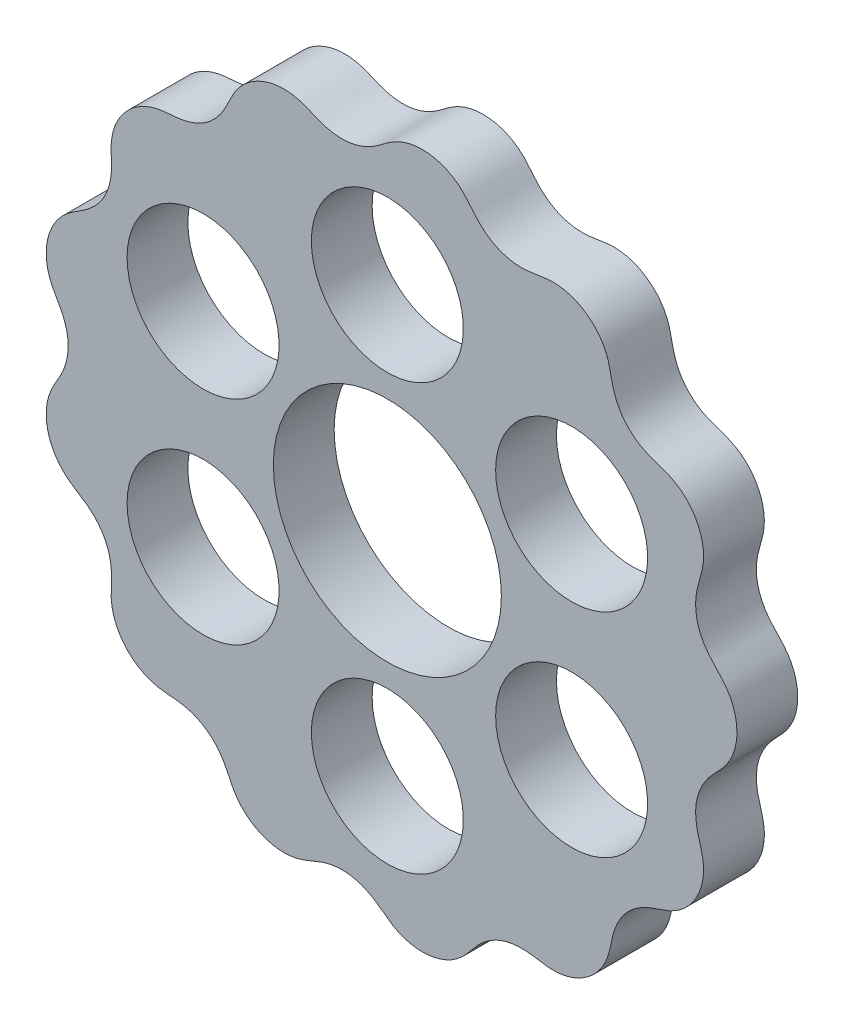
from build123d import *

# Parameters (mm, degrees)
LOBEBASE_DEPTH      = 4
LOBEBASE_DEPTH_BACK = 4
LOBEBASESKETCH_R    = 6.5
SKETCH_5_R          = 5
CUT_EXTRUDE_1_DEPTH = 10
SKETCH_6_R          = 7.5
CUT_EXTRUDE_2_DEPTH = 10
SKETCH_7_W          = 69.827871662
SKETCH_7_H          = 56.498152212
CUT_EXTRUDE_3_DEPTH = 4


with BuildPart() as part:
    # LobeBaseSketch → LobeBase (new, two sides: drawn at the far end of the back side and taken through both)
    with BuildSketch(Plane.XY.offset(-LOBEBASE_DEPTH_BACK)):
        with BuildLine():
            add(Edge.make_bspline(
                [(23, 0), (23, 0.04430048), (22.998484829, 0.132821599), (22.991681512, 0.265248966), (22.980399102, 0.396891972), (22.964721454, 0.527368676), (22.944764325, 0.656309365), (22.92067373, 0.783360531), (22.892623822, 0.908188775), (22.860814288, 1.030484612), (22.825467261, 1.149966178), (22.786823724, 1.266382827), (22.745139396, 1.379518628), (22.70068008, 1.489195762), (22.653716425, 1.595277859), (22.604518087, 1.6976733), (22.553347199, 1.796338552), (22.500451113, 1.891281616), (22.446054299, 1.982565722), (22.390349303, 2.070313421), (22.333486628, 2.154711337), (22.27556338, 2.236015872), (22.216610506, 2.314560327), (22.156578465, 2.390764035), (22.095321193, 2.465144312), (22.032578346, 2.538332356), (21.967956062, 2.611094541), (21.900906971, 2.684361049), (21.830711136, 2.759264251), (21.756461301, 2.837189672), (21.677058807, 2.919842341), (21.591231419, 3.009330157), (21.497591992, 3.108261919), (21.394767597, 3.219848144), (21.281640661, 3.347972943), (21.157749072, 3.497169882), (21.023871596, 3.672383574), (20.882743958, 3.878351565), (20.739678847, 4.118461681), (20.602640028, 4.393136809), (20.481250295, 4.698228691), (20.384604573, 5.024353774), (20.318622227, 5.3580367), (20.28432423, 5.684594767), (20.278018181, 5.991492629), (20.293111311, 6.27058525), (20.322355531, 6.518546132), (20.359472285, 6.735906117), (20.399837565, 6.925588738), (20.44046393, 7.091610322), (20.479653705, 7.238199896), (20.516591418, 7.369316033), (20.551000734, 7.488439534), (20.58289754, 7.598525017), (20.612428755, 7.702030169), (20.639774827, 7.800975292), (20.665095204, 7.897008829), (20.688501121, 7.991468017), (20.710044973, 8.085430867), (20.729719356, 8.179759006), (20.747461459, 8.275132318), (20.763160208, 8.372076746), (20.776664596, 8.470986612), (20.787792327, 8.572142657), (20.796338262, 8.675726789), (20.80208241, 8.78183431), (20.804797326, 8.890484256), (20.804254868, 9.001628295), (20.800232299, 9.115158563), (20.792517741, 9.230914694), (20.780915005, 9.348690247), (20.765247817, 9.468238697), (20.745363455, 9.589279067), (20.72113584, 9.711501322), (20.692468074, 9.834571536), (20.659294457, 9.958136899), (20.621581998, 10.081830577), (20.579331433, 10.205276427), (20.532577753, 10.328093577), (20.481390276, 10.449900868), (20.425872247, 10.570321136), (20.366160004, 10.688985342), (20.302421697, 10.805536507), (20.234855594, 10.919633458), (20.163687961, 11.030954354), (20.089170544, 11.139199971), (20.011577658, 11.244096741), (19.931202875, 11.345399504), (19.848355338, 11.442893982), (19.763355685, 11.536398941), (19.676531595, 11.625768031), (19.588212927, 11.710891307), (19.49872646, 11.79169641), (19.408390185, 11.868149415), (19.317507126, 11.940255348), (19.226358626, 12.008058401), (19.135197027, 12.071641845), (19.044237626, 12.131127717), (18.9536498, 12.186676318), (18.863547086, 12.238485645), (18.773976021, 12.286790885), (18.684903431, 12.3318642), (18.596201825, 12.374015095), (18.507632464, 12.413591846), (18.418825605, 12.450984637), (18.329257392, 12.486631377), (18.238222928, 12.52102762), (18.144805263, 12.554742624), (18.047840684, 12.588444485), (17.945881972, 12.622938399), (17.837163944, 12.659223525), (17.719580505, 12.698575074), (17.590691028, 12.742658387), (17.447787844, 12.793678204), (17.288076353, 12.85455437), (17.109040524, 12.929086407), (16.909072043, 13.022014461), (16.688391628, 13.138804776), (16.450129029, 13.284926052), (16.201139284, 13.464453685), (15.951870746, 13.678186509), (15.714737327, 13.922042422), (15.501242673, 14.186840454), (15.319114204, 14.460054189), (15.170907927, 14.728868183), (15.054571422, 14.983006553), (14.965232724, 15.216155477), (14.897085757, 15.425867201), (14.844677528, 15.612581502), (14.80349631, 15.778466327), (14.770073561, 15.926477345), (14.741847574, 16.059740729), (14.716956059, 16.181210158), (14.694040003, 16.293509197), (14.672087353, 16.398882298), (14.650319006, 16.499202206), (14.628110076, 16.596002646), (14.604937613, 16.690519375), (14.580347033, 16.783731274), (14.553931362, 16.876397835), (14.525319026, 16.969091875), (14.494167256, 17.062227475), (14.460159091, 17.156083614), (14.423002649, 17.250824159), (14.382431752, 17.346514846), (14.338207319, 17.443137829), (14.29011911, 17.540604263), (14.237987578, 17.638765329), (14.181665623, 17.737422008), (14.121040165, 17.836333837), (14.056033424, 17.935226851), (13.986603883, 18.03380084), (13.91274689, 18.131736042), (13.834494888, 18.22869934), (13.751917262, 18.324350027), (13.665119796, 18.418345173), (13.574243753, 18.510344633), (13.479464588, 18.600015687), (13.380990285, 18.687037355), (13.279059355, 18.771104348), (13.173938492, 18.851930686), (13.065919921, 18.929252959), (12.955318426, 19.002833222), (12.842468116, 19.072461521), (12.727718906, 19.13795803), (12.611432764, 19.199174795), (12.493979716, 19.255997059), (12.375733639, 19.308344177), (12.257067844, 19.35617008), (12.138350469, 19.399463301), (12.019939668, 19.438246533), (11.902178613, 19.47257572), (11.785390277, 19.502538651), (11.669871995, 19.528253064), (11.555889744, 19.549864233), (11.443672107, 19.567542035), (11.333403819, 19.581477471), (11.225218807, 19.591878654), (11.119192548, 19.598966235), (11.015333563, 19.602968297), (10.913573759, 19.604114714), (10.813757283, 19.602631055), (10.715627414, 19.598732127), (10.618810907, 19.592615366), (10.522799042, 19.584454433), (10.426924462, 19.574393629), (10.330332716, 19.562544165), (10.231947338, 19.548983965), (10.130427432, 19.533763794), (10.024117354, 19.516924062), (9.910989783, 19.498529159), (9.788587241, 19.478729476), (9.65397474, 19.457865385), (9.503730163, 19.436630768), (9.334022097, 19.416312306), (9.140856978, 19.399105048), (8.920607862, 19.388458767), (8.670929893, 19.389316152), (8.392052896, 19.407973966), (8.088152775, 19.451226486), (7.76810985, 19.524636637), (7.444813142, 19.63035893), (7.132715232, 19.765610031), (6.844479729, 19.922889459), (6.588325496, 20.092037539), (6.367210647, 20.26300162), (6.179755452, 20.427926976), (6.021956411, 20.581948011), (5.888780766, 20.722919996), (5.775226087, 20.850665847), (5.676847562, 20.966190769), (5.58992411, 21.071072366), (5.51143411, 21.167060539), (5.438954984, 21.255846778), (5.370547556, 21.33894812), (5.304651656, 21.417660732), (5.240001218, 21.49305226), (5.175558907, 21.565973887), (5.1104673, 21.637081113), (5.044013087, 21.706857302), (4.975601053, 21.775636984), (4.904735259, 21.843627513), (4.831005402, 21.910928614), (4.75407688, 21.97754974), (4.673683455, 22.0434254), (4.589621725, 22.108428684), (4.501746821, 22.17238322), (4.409968919, 22.235073796), (4.31425026, 22.29625583), (4.214602464, 22.35566385), (4.111083979, 22.413019126), (4.003797556, 22.468036541), (3.892887679, 22.5204308), (3.778537881, 22.569922019), (3.660967934, 22.616240759), (3.540430872, 22.659132534), (3.417209852, 22.698361807), (3.291614852, 22.733715509), (3.163979201, 22.765006078), (3.034655965, 22.792074038), (2.904014192, 22.814790105), (2.772435045, 22.833056845), (2.640307832, 22.846809855), (2.508025961, 22.856018497), (2.375982836, 22.86068616), (2.244567722, 22.860850048), (2.11416159, 22.856580511), (1.98513297, 22.84797989), (1.857833821, 22.835180879), (1.732595443, 22.818344407), (1.609724419, 22.797657011), (1.489498614, 22.773327705), (1.372163211, 22.745584317), (1.257926768, 22.714669277), (1.146957286, 22.680834824), (1.039378219, 22.644337604), (0.935264379, 22.605432591), (0.834637638, 22.564366299), (0.737462285, 22.521369181), (0.643639869, 22.476647154), (0.553003271, 22.430372117), (0.465309662, 22.382671373), (0.3802319, 22.33361582), (0.297347741, 22.283206822), (0.216126031, 22.231361736), (0.135908796, 22.177898198), (0.055887773, 22.122517596), (-0.024926414, 22.064788671), (-0.10774466, 22.004133225), (-0.194051745, 21.939817627), (-0.285672697, 21.870956745), (-0.384853394, 21.7965417), (-0.494350818, 21.715509915), (-0.617517565, 21.626885459), (-0.758344135, 21.530027084), (-0.921386741, 21.425022507), (-1.111460075, 21.313240826), (-1.332937384, 21.197968865), (-1.58854142, 21.084888936), (-1.877732062, 20.981957712), (-2.195231396, 20.89822781), (-2.530628014, 20.841596779), (-2.869831309, 20.81631655), (-3.198142567, 20.82163085), (-3.503562909, 20.852363229), (-3.778801354, 20.900987211), (-4.021429321, 20.959906589), (-4.232730576, 21.022952572), (-4.416164701, 21.085887256), (-4.576078833, 21.146229099), (-4.716875799, 21.202802558), (-4.842583602, 21.255275257), (-4.956690974, 21.303792442), (-5.062129075, 21.348726023), (-5.161319964, 21.39051809), (-5.25624746, 21.429591294), (-5.34852877, 21.466302621), (-5.439477973, 21.50092368), (-5.530158904, 21.533636423), (-5.621427799, 21.564537358), (-5.713967158, 21.593646084), (-5.808312477, 21.620915731), (-5.904873405, 21.646243923), (-6.003950609, 21.669483534), (-6.105749397, 21.690452847), (-6.210390895, 21.708944962), (-6.317921413, 21.724736388), (-6.428320473, 21.737594818), (-6.541507845, 21.74728614), (-6.65734987, 21.753580689), (-6.775665262, 21.756258825), (-6.89623054, 21.755115841), (-7.018785185, 21.749966263), (-7.143036618, 21.74064756), (-7.268665028, 21.727023289), (-7.395328098, 21.708985704), (-7.522665645, 21.686457836), (-7.650304179, 21.659395078), (-7.777861387, 21.627786257), (-7.904950534, 21.59165424), (-8.031184762, 21.55105606), (-8.156181288, 21.506082576), (-8.279565467, 21.456857684), (-8.400974717, 21.403537081), (-8.520062268, 21.346306591), (-8.636500735, 21.285380058), (-8.749985478, 21.22099682), (-8.86023774, 21.153418758), (-8.967007541, 21.082926933), (-9.070076319, 21.009817801), (-9.169259295, 20.93439901), (-9.264407566, 20.856984762), (-9.355409911, 20.77789073), (-9.442194321, 20.6974285), (-9.524729264, 20.61589949), (-9.603024693, 20.533588321), (-9.677132859, 20.450755529), (-9.747148956, 20.367629555), (-9.813211701, 20.28439786), (-9.875503961, 20.201197021), (-9.934253601, 20.118101583), (-9.989734795, 20.035111419), (-10.04227016, 19.952137277), (-10.092234209, 19.868984137), (-10.140058848, 19.785331983), (-10.186241938, 19.700713563), (-10.231360385, 19.614488851), (-10.276089825, 19.525816201), (-10.321233749, 19.433620913), (-10.367765929, 19.336563377), (-10.416891005, 19.233011715), (-10.470128755, 19.121028896), (-10.529426561, 18.998392825), (-10.597299461, 18.862681325), (-10.676982864, 18.711472122), (-10.772551863, 18.54272551), (-10.888905904, 18.355416264), (-11.031444771, 18.150422374), (-11.205220041, 17.931509951), (-11.413451112, 17.705975286), (-11.655671585, 17.484286842), (-11.92633279, 17.278275974), (-12.214934083, 17.098255812), (-12.508108943, 16.950387542), (-12.792827273, 16.835663802), (-13.059135504, 16.750808516), (-13.3013531, 16.690224196), (-13.517749999, 16.647852052), (-13.709420056, 16.618331859), (-13.879059241, 16.597446105), (-14.03001976, 16.582107802), (-14.16571377, 16.570150741), (-14.289297891, 16.560082235), (-14.403540369, 16.550869416), (-14.51079128, 16.541778149), (-14.613003628, 16.532260746), (-14.711775274, 16.521881748), (-14.808396002, 16.510270971), (-14.903892348, 16.497095137), (-14.999067322, 16.482041786), (-15.094534355, 16.464811098), (-15.190745823, 16.445112715), (-15.288016876, 16.422665616), (-15.386545369, 16.397199796), (-15.486428645, 16.368458945), (-15.587677804, 16.336203571), (-15.690229991, 16.30021426), (-15.793959114, 16.260294834), (-15.898685336, 16.216275279), (-16.004183578, 16.168014352), (-16.110191247, 16.115401819), (-16.216415327, 16.058360278), (-16.322538948, 15.99684657), (-16.428227511, 15.930852748), (-16.53313443, 15.860406622), (-16.636906524, 15.78557187), (-16.7391891, 15.706447726), (-16.839630718, 15.623168259), (-16.937887665, 15.535901247), (-17.033628131, 15.444846664), (-17.126536074, 15.35023479), (-17.21631478, 15.252323965), (-17.302690098, 15.151398), (-17.38541333, 15.04776326), (-17.464263785, 14.941745433), (-17.539050955, 14.833686014), (-17.609616322, 14.723938498), (-17.67583476, 14.612864315), (-17.737615539, 14.500828503), (-17.794902902, 14.388195132), (-17.847676206, 14.275322482), (-17.895949621, 14.162557963), (-17.939771366, 14.050232778), (-17.979222483, 13.938656284), (-18.014415125, 13.828110032), (-18.045490377, 13.71884141), (-18.072615581, 13.611056834), (-18.09598119, 13.504914336), (-18.115797148, 13.400515442), (-18.132288848, 13.297896101), (-18.145692695, 13.197016426), (-18.1562514, 13.097748889), (-18.164209149, 12.999864534), (-18.169806926, 12.903016633), (-18.173278446, 12.806721111), (-18.174847401, 12.710332869), (-18.174727181, 12.613017091), (-18.173124897, 12.513714551), (-18.170252571, 12.411100251), (-18.166349883, 12.303535488), (-18.161725121, 12.189015483), (-18.156823797, 12.065118806), (-18.152337572, 11.928972893), (-18.149367762, 11.777264218), (-18.149653491, 11.606344395), (-18.155855176, 11.412513562), (-18.171834615, 11.192587042), (-18.202781103, 10.944832853), (-18.254917788, 10.670238134), (-18.33448606, 10.373767303), (-18.44593788, 10.064906467), (-18.589858451, 9.756710369), (-18.761742664, 9.463190724), (-18.952618299, 9.196014722), (-19.15140908, 8.96211669), (-19.34777909, 8.76322146), (-19.534097182, 8.597012579), (-19.706015803, 8.458929255), (-19.862012493, 8.343716906), (-20.002514437, 8.246388229), (-20.129055273, 8.162651985), (-20.243649629, 8.089004382), (-20.348398865, 8.022656758), (-20.445274145, 7.961408085), (-20.536015189, 7.903516184), (-20.62209677, 7.847588496), (-20.704731359, 7.792496877), (-20.784888967, 7.737314154), (-20.863323667, 7.681268167), (-20.94060128, 7.623709071), (-21.017125639, 7.564086312), (-21.093162369, 7.501932562), (-21.168859921, 7.43685253), (-21.244268013, 7.368515193), (-21.319353722, 7.29664836), (-21.39401558, 7.221034815), (-21.468095965, 7.141509485), (-21.54139206, 7.057957261), (-21.613665617, 6.970311178), (-21.6846517, 6.878550772), (-21.754066566, 6.782700468), (-21.821614792, 6.682827901), (-21.886995747, 6.579042111), (-21.949909463, 6.47149156), (-22.010061979, 6.360361937), (-22.067170162, 6.245873758), (-22.120966062, 6.128279724), (-22.1712008, 6.007861871), (-22.217648003, 5.884928489), (-22.260106801, 5.759810847), (-22.298404368, 5.632859719), (-22.332398036, 5.504441744), (-22.361976947, 5.374935629), (-22.387063266, 5.244728221), (-22.407612935, 5.114210464), (-22.42361597, 4.983773269), (-22.435096285, 4.853803309), (-22.442111054, 4.724678762), (-22.444749579, 4.596765017), (-22.443131682, 4.470410355), (-22.437405586, 4.345941609), (-22.427745288, 4.223659813), (-22.4143474, 4.10383582), (-22.397427446, 3.986705894), (-22.377215578, 3.872467212), (-22.353951687, 3.761273263), (-22.327879873, 3.653229049), (-22.299242213, 3.548385995), (-22.268271788, 3.44673643), (-22.235184876, 3.348207441), (-22.200172271, 3.252653847), (-22.163389616, 3.159849933), (-22.124946724, 3.069479491), (-22.084895846, 2.981123517), (-22.043218964, 2.894244771), (-21.999814355, 2.808168092), (-21.954483008, 2.722055118), (-21.906916066, 2.634871704), (-21.856685503, 2.54534609), (-21.803242007, 2.451915893), (-21.745926884, 2.352662699), (-21.68400932, 2.245235398), (-21.616766805, 2.126769032), (-21.543634632, 1.993817811), (-21.46445723, 1.842343038), (-21.37987087, 1.667832293), (-21.291815011, 1.465671015), (-21.204079652, 1.231914025), (-21.122633866, 0.964543351), (-21.055311206, 0.665054247), (-21.010462104, 0.339777315), (-20.994671573, 0), (-21.010462104, -0.339777315), (-21.055311206, -0.665054247), (-21.122633866, -0.964543351), (-21.204079652, -1.231914025), (-21.291815011, -1.465671015), (-21.37987087, -1.667832293), (-21.46445723, -1.842343038), (-21.543634632, -1.993817811), (-21.616766805, -2.126769032), (-21.68400932, -2.245235398), (-21.745926884, -2.352662699), (-21.803242007, -2.451915893), (-21.856685503, -2.54534609), (-21.906916066, -2.634871704), (-21.954483008, -2.722055118), (-21.999814355, -2.808168092), (-22.043218964, -2.894244771), (-22.084895846, -2.981123517), (-22.124946724, -3.069479491), (-22.163389616, -3.159849933), (-22.200172271, -3.252653847), (-22.235184876, -3.348207441), (-22.268271788, -3.44673643), (-22.299242213, -3.548385995), (-22.327879873, -3.653229049), (-22.353951687, -3.761273263), (-22.377215578, -3.872467212), (-22.397427446, -3.986705894), (-22.4143474, -4.10383582), (-22.427745288, -4.223659813), (-22.437405586, -4.345941609), (-22.443131682, -4.470410355), (-22.444749579, -4.596765017), (-22.442111054, -4.724678762), (-22.435096285, -4.853803309), (-22.42361597, -4.983773269), (-22.407612935, -5.114210464), (-22.387063266, -5.244728221), (-22.361976947, -5.374935629), (-22.332398036, -5.504441744), (-22.298404368, -5.632859719), (-22.260106801, -5.759810847), (-22.217648003, -5.884928489), (-22.1712008, -6.007861871), (-22.120966062, -6.128279724), (-22.067170162, -6.245873758), (-22.010061979, -6.360361937), (-21.949909463, -6.47149156), (-21.886995747, -6.579042111), (-21.821614792, -6.682827901), (-21.754066566, -6.782700468), (-21.6846517, -6.878550772), (-21.613665617, -6.970311178), (-21.54139206, -7.057957261), (-21.468095965, -7.141509485), (-21.39401558, -7.221034815), (-21.319353722, -7.29664836), (-21.244268013, -7.368515193), (-21.168859921, -7.43685253), (-21.093162369, -7.501932562), (-21.017125639, -7.564086312), (-20.94060128, -7.623709071), (-20.863323667, -7.681268167), (-20.784888967, -7.737314154), (-20.704731359, -7.792496877), (-20.62209677, -7.847588496), (-20.536015189, -7.903516184), (-20.445274145, -7.961408085), (-20.348398865, -8.022656758), (-20.243649629, -8.089004382), (-20.129055273, -8.162651985), (-20.002514437, -8.246388229), (-19.862012493, -8.343716906), (-19.706015803, -8.458929255), (-19.534097182, -8.597012579), (-19.34777909, -8.76322146), (-19.15140908, -8.96211669), (-18.952618299, -9.196014722), (-18.761742664, -9.463190724), (-18.589858451, -9.756710369), (-18.44593788, -10.064906467), (-18.33448606, -10.373767303), (-18.254917788, -10.670238134), (-18.202781103, -10.944832853), (-18.171834615, -11.192587042), (-18.155855176, -11.412513562), (-18.149653491, -11.606344395), (-18.149367762, -11.777264218), (-18.152337572, -11.928972893), (-18.156823797, -12.065118806), (-18.161725121, -12.189015483), (-18.166349883, -12.303535488), (-18.170252571, -12.411100251), (-18.173124897, -12.513714551), (-18.174727181, -12.613017091), (-18.174847401, -12.710332869), (-18.173278446, -12.806721111), (-18.169806926, -12.903016633), (-18.164209149, -12.999864534), (-18.1562514, -13.097748889), (-18.145692695, -13.197016426), (-18.132288848, -13.297896101), (-18.115797148, -13.400515442), (-18.09598119, -13.504914336), (-18.072615581, -13.611056834), (-18.045490377, -13.71884141), (-18.014415125, -13.828110032), (-17.979222483, -13.938656284), (-17.939771366, -14.050232778), (-17.895949621, -14.162557963), (-17.847676206, -14.275322482), (-17.794902902, -14.388195132), (-17.737615539, -14.500828503), (-17.67583476, -14.612864315), (-17.609616322, -14.723938498), (-17.539050955, -14.833686014), (-17.464263785, -14.941745433), (-17.38541333, -15.04776326), (-17.302690098, -15.151398), (-17.21631478, -15.252323965), (-17.126536074, -15.35023479), (-17.033628131, -15.444846664), (-16.937887665, -15.535901247), (-16.839630718, -15.623168259), (-16.7391891, -15.706447726), (-16.636906524, -15.78557187), (-16.53313443, -15.860406622), (-16.428227511, -15.930852748), (-16.322538948, -15.99684657), (-16.216415327, -16.058360278), (-16.110191247, -16.115401819), (-16.004183578, -16.168014352), (-15.898685336, -16.216275279), (-15.793959114, -16.260294834), (-15.690229991, -16.30021426), (-15.587677804, -16.336203571), (-15.486428645, -16.368458945), (-15.386545369, -16.397199796), (-15.288016876, -16.422665616), (-15.190745823, -16.445112715), (-15.094534355, -16.464811098), (-14.999067322, -16.482041786), (-14.903892348, -16.497095137), (-14.808396002, -16.510270971), (-14.711775274, -16.521881748), (-14.613003628, -16.532260746), (-14.51079128, -16.541778149), (-14.403540369, -16.550869416), (-14.289297891, -16.560082235), (-14.16571377, -16.570150741), (-14.03001976, -16.582107802), (-13.879059241, -16.597446105), (-13.709420056, -16.618331859), (-13.517749999, -16.647852052), (-13.3013531, -16.690224196), (-13.059135504, -16.750808516), (-12.792827273, -16.835663802), (-12.508108943, -16.950387542), (-12.214934083, -17.098255812), (-11.92633279, -17.278275974), (-11.655671585, -17.484286842), (-11.413451112, -17.705975286), (-11.205220041, -17.931509951), (-11.031444771, -18.150422374), (-10.888905904, -18.355416264), (-10.772551863, -18.54272551), (-10.676982864, -18.711472122), (-10.597299461, -18.862681325), (-10.529426561, -18.998392825), (-10.470128755, -19.121028896), (-10.416891005, -19.233011715), (-10.367765929, -19.336563377), (-10.321233749, -19.433620913), (-10.276089825, -19.525816201), (-10.231360385, -19.614488851), (-10.186241938, -19.700713563), (-10.140058848, -19.785331983), (-10.092234209, -19.868984137), (-10.04227016, -19.952137277), (-9.989734795, -20.035111419), (-9.934253601, -20.118101583), (-9.875503961, -20.201197021), (-9.813211701, -20.28439786), (-9.747148956, -20.367629555), (-9.677132859, -20.450755529), (-9.603024693, -20.533588321), (-9.524729264, -20.61589949), (-9.442194321, -20.6974285), (-9.355409911, -20.77789073), (-9.264407566, -20.856984762), (-9.169259295, -20.93439901), (-9.070076319, -21.009817801), (-8.967007541, -21.082926933), (-8.86023774, -21.153418758), (-8.749985478, -21.22099682), (-8.636500735, -21.285380058), (-8.520062268, -21.346306591), (-8.400974717, -21.403537081), (-8.279565467, -21.456857684), (-8.156181288, -21.506082576), (-8.031184762, -21.55105606), (-7.904950534, -21.59165424), (-7.777861387, -21.627786257), (-7.650304179, -21.659395078), (-7.522665645, -21.686457836), (-7.395328098, -21.708985704), (-7.268665028, -21.727023289), (-7.143036618, -21.74064756), (-7.018785185, -21.749966263), (-6.89623054, -21.755115841), (-6.775665262, -21.756258825), (-6.65734987, -21.753580689), (-6.541507845, -21.74728614), (-6.428320473, -21.737594818), (-6.317921413, -21.724736388), (-6.210390895, -21.708944962), (-6.105749397, -21.690452847), (-6.003950609, -21.669483534), (-5.904873405, -21.646243923), (-5.808312477, -21.620915731), (-5.713967158, -21.593646084), (-5.621427799, -21.564537358), (-5.530158904, -21.533636423), (-5.439477973, -21.50092368), (-5.34852877, -21.466302621), (-5.25624746, -21.429591294), (-5.161319964, -21.39051809), (-5.062129075, -21.348726023), (-4.956690974, -21.303792442), (-4.842583602, -21.255275257), (-4.716875799, -21.202802558), (-4.576078833, -21.146229099), (-4.416164701, -21.085887256), (-4.232730576, -21.022952572), (-4.021429321, -20.959906589), (-3.778801354, -20.900987211), (-3.503562909, -20.852363229), (-3.198142567, -20.82163085), (-2.869831309, -20.81631655), (-2.530628014, -20.841596779), (-2.195231396, -20.89822781), (-1.877732062, -20.981957712), (-1.58854142, -21.084888936), (-1.332937384, -21.197968865), (-1.111460075, -21.313240826), (-0.921386741, -21.425022507), (-0.758344135, -21.530027084), (-0.617517565, -21.626885459), (-0.494350818, -21.715509915), (-0.384853394, -21.7965417), (-0.285672697, -21.870956745), (-0.194051745, -21.939817627), (-0.10774466, -22.004133225), (-0.024926414, -22.064788671), (0.055887773, -22.122517596), (0.135908796, -22.177898198), (0.216126031, -22.231361736), (0.297347741, -22.283206822), (0.3802319, -22.33361582), (0.465309662, -22.382671373), (0.553003271, -22.430372117), (0.643639869, -22.476647154), (0.737462285, -22.521369181), (0.834637638, -22.564366299), (0.935264379, -22.605432591), (1.039378219, -22.644337604), (1.146957286, -22.680834824), (1.257926768, -22.714669277), (1.372163211, -22.745584317), (1.489498614, -22.773327705), (1.609724419, -22.797657011), (1.732595443, -22.818344407), (1.857833821, -22.835180879), (1.98513297, -22.84797989), (2.11416159, -22.856580511), (2.244567722, -22.860850048), (2.375982836, -22.86068616), (2.508025961, -22.856018497), (2.640307832, -22.846809855), (2.772435045, -22.833056845), (2.904014192, -22.814790105), (3.034655965, -22.792074038), (3.163979201, -22.765006078), (3.291614852, -22.733715509), (3.417209852, -22.698361807), (3.540430872, -22.659132534), (3.660967934, -22.616240759), (3.778537881, -22.569922019), (3.892887679, -22.5204308), (4.003797556, -22.468036541), (4.111083979, -22.413019126), (4.214602464, -22.35566385), (4.31425026, -22.29625583), (4.409968919, -22.235073796), (4.501746821, -22.17238322), (4.589621725, -22.108428684), (4.673683455, -22.0434254), (4.75407688, -21.97754974), (4.831005402, -21.910928614), (4.904735259, -21.843627513), (4.975601053, -21.775636984), (5.044013087, -21.706857302), (5.1104673, -21.637081113), (5.175558907, -21.565973887), (5.240001218, -21.49305226), (5.304651656, -21.417660732), (5.370547556, -21.33894812), (5.438954984, -21.255846778), (5.51143411, -21.167060539), (5.58992411, -21.071072366), (5.676847562, -20.966190769), (5.775226087, -20.850665847), (5.888780766, -20.722919996), (6.021956411, -20.581948011), (6.179755452, -20.427926976), (6.367210647, -20.26300162), (6.588325496, -20.092037539), (6.844479729, -19.922889459), (7.132715232, -19.765610031), (7.444813142, -19.63035893), (7.76810985, -19.524636637), (8.088152775, -19.451226486), (8.392052896, -19.407973966), (8.670929893, -19.389316152), (8.920607862, -19.388458767), (9.140856978, -19.399105048), (9.334022097, -19.416312306), (9.503730163, -19.436630768), (9.65397474, -19.457865385), (9.788587241, -19.478729476), (9.910989783, -19.498529159), (10.024117354, -19.516924062), (10.130427432, -19.533763794), (10.231947338, -19.548983965), (10.330332716, -19.562544165), (10.426924462, -19.574393629), (10.522799042, -19.584454433), (10.618810907, -19.592615366), (10.715627414, -19.598732127), (10.813757283, -19.602631055), (10.913573759, -19.604114714), (11.015333563, -19.602968297), (11.119192548, -19.598966235), (11.225218807, -19.591878654), (11.333403819, -19.581477471), (11.443672107, -19.567542035), (11.555889744, -19.549864233), (11.669871995, -19.528253064), (11.785390277, -19.502538651), (11.902178613, -19.47257572), (12.019939668, -19.438246533), (12.138350469, -19.399463301), (12.257067844, -19.35617008), (12.375733639, -19.308344177), (12.493979716, -19.255997059), (12.611432764, -19.199174795), (12.727718906, -19.13795803), (12.842468116, -19.072461521), (12.955318426, -19.002833222), (13.065919921, -18.929252959), (13.173938492, -18.851930686), (13.279059355, -18.771104348), (13.380990285, -18.687037355), (13.479464588, -18.600015687), (13.574243753, -18.510344633), (13.665119796, -18.418345173), (13.751917262, -18.324350027), (13.834494888, -18.22869934), (13.91274689, -18.131736042), (13.986603883, -18.03380084), (14.056033424, -17.935226851), (14.121040165, -17.836333837), (14.181665623, -17.737422008), (14.237987578, -17.638765329), (14.29011911, -17.540604263), (14.338207319, -17.443137829), (14.382431752, -17.346514846), (14.423002649, -17.250824159), (14.460159091, -17.156083614), (14.494167256, -17.062227475), (14.525319026, -16.969091875), (14.553931362, -16.876397835), (14.580347033, -16.783731274), (14.604937613, -16.690519375), (14.628110076, -16.596002646), (14.650319006, -16.499202206), (14.672087353, -16.398882298), (14.694040003, -16.293509197), (14.716956059, -16.181210158), (14.741847574, -16.059740729), (14.770073561, -15.926477345), (14.80349631, -15.778466327), (14.844677528, -15.612581502), (14.897085757, -15.425867201), (14.965232724, -15.216155477), (15.054571422, -14.983006553), (15.170907927, -14.728868183), (15.319114204, -14.460054189), (15.501242673, -14.186840454), (15.714737327, -13.922042422), (15.951870746, -13.678186509), (16.201139284, -13.464453685), (16.450129029, -13.284926052), (16.688391628, -13.138804776), (16.909072043, -13.022014461), (17.109040524, -12.929086407), (17.288076353, -12.85455437), (17.447787844, -12.793678204), (17.590691028, -12.742658387), (17.719580505, -12.698575074), (17.837163944, -12.659223525), (17.945881972, -12.622938399), (18.047840684, -12.588444485), (18.144805263, -12.554742624), (18.238222928, -12.52102762), (18.329257392, -12.486631377), (18.418825605, -12.450984637), (18.507632464, -12.413591846), (18.596201825, -12.374015095), (18.684903431, -12.3318642), (18.773976021, -12.286790885), (18.863547086, -12.238485645), (18.9536498, -12.186676318), (19.044237626, -12.131127717), (19.135197027, -12.071641845), (19.226358626, -12.008058401), (19.317507126, -11.940255348), (19.408390185, -11.868149415), (19.49872646, -11.79169641), (19.588212927, -11.710891307), (19.676531595, -11.625768031), (19.763355685, -11.536398941), (19.848355338, -11.442893982), (19.931202875, -11.345399504), (20.011577658, -11.244096741), (20.089170544, -11.139199971), (20.163687961, -11.030954354), (20.234855594, -10.919633458), (20.302421697, -10.805536507), (20.366160004, -10.688985342), (20.425872247, -10.570321136), (20.481390276, -10.449900868), (20.532577753, -10.328093577), (20.579331433, -10.205276427), (20.621581998, -10.081830577), (20.659294457, -9.958136899), (20.692468074, -9.834571536), (20.72113584, -9.711501322), (20.745363455, -9.589279067), (20.765247817, -9.468238697), (20.780915005, -9.348690247), (20.792517741, -9.230914694), (20.800232299, -9.115158563), (20.804254868, -9.001628295), (20.804797326, -8.890484256), (20.80208241, -8.78183431), (20.796338262, -8.675726789), (20.787792327, -8.572142657), (20.776664596, -8.470986612), (20.763160208, -8.372076746), (20.747461459, -8.275132318), (20.729719356, -8.179759006), (20.710044973, -8.085430867), (20.688501121, -7.991468017), (20.665095204, -7.897008829), (20.639774827, -7.800975292), (20.612428755, -7.702030169), (20.58289754, -7.598525017), (20.551000734, -7.488439534), (20.516591418, -7.369316033), (20.479653705, -7.238199896), (20.44046393, -7.091610322), (20.399837565, -6.925588738), (20.359472285, -6.735906117), (20.322355531, -6.518546132), (20.293111311, -6.27058525), (20.278018181, -5.991492629), (20.28432423, -5.684594767), (20.318622227, -5.3580367), (20.384604573, -5.024353774), (20.481250295, -4.698228691), (20.602640028, -4.393136809), (20.739678847, -4.118461681), (20.882743958, -3.878351565), (21.023871596, -3.672383574), (21.157749072, -3.497169882), (21.281640661, -3.347972943), (21.394767597, -3.219848144), (21.497591992, -3.108261919), (21.591231419, -3.009330157), (21.677058807, -2.919842341), (21.756461301, -2.837189672), (21.830711136, -2.759264251), (21.900906971, -2.684361049), (21.967956062, -2.611094541), (22.032578346, -2.538332356), (22.095321193, -2.465144312), (22.156578465, -2.390764035), (22.216610506, -2.314560327), (22.27556338, -2.236015872), (22.333486628, -2.154711337), (22.390349303, -2.070313421), (22.446054299, -1.982565722), (22.500451113, -1.891281616), (22.553347199, -1.796338552), (22.604518087, -1.6976733), (22.653716425, -1.595277859), (22.70068008, -1.489195762), (22.745139396, -1.379518628), (22.786823724, -1.266382827), (22.825467261, -1.149966178), (22.860814288, -1.030484612), (22.892623822, -0.908188775), (22.92067373, -0.783360531), (22.944764325, -0.656309365), (22.964721454, -0.527368676), (22.980399102, -0.396891972), (22.991681512, -0.265248966), (22.998484829, -0.132821599), (23, -0.04430048), (23, 0)],
                knots=[0, 0, 0, 0, 0.000881302, 0.001761015, 0.002637564, 0.003509391, 0.004374977, 0.005232848, 0.006081585, 0.006919847, 0.007746377, 0.008560023, 0.009359752, 0.010144678, 0.010914076, 0.011667416, 0.012404388, 0.013124944, 0.013829336, 0.014518167, 0.015192456, 0.015853705, 0.016503991, 0.017146071, 0.017783517, 0.018420869, 0.01906383, 0.019719503, 0.020396662, 0.021106076, 0.021860867, 0.022676861, 0.023572889, 0.02457088, 0.025695497, 0.026972932, 0.028428275, 0.030080873, 0.031937506, 0.033984429, 0.036181314, 0.038461538, 0.040741763, 0.042938648, 0.044985571, 0.046842204, 0.048494802, 0.049950145, 0.05122758, 0.052352197, 0.053350188, 0.054246216, 0.05506221, 0.055817, 0.056526415, 0.057203574, 0.057859247, 0.058502208, 0.05913956, 0.059777005, 0.060419086, 0.061069372, 0.061730621, 0.06240491, 0.063093741, 0.063798133, 0.064518689, 0.065255661, 0.066009001, 0.066778399, 0.067563324, 0.068363054, 0.0691767, 0.070003229, 0.070841492, 0.071690229, 0.0725481, 0.073413686, 0.074285513, 0.075162061, 0.076041775, 0.076923077, 0.077804379, 0.078684092, 0.07956064, 0.080432468, 0.081298054, 0.082155924, 0.083004662, 0.083842924, 0.084669454, 0.0854831, 0.086282829, 0.087067755, 0.087837153, 0.088590493, 0.089327465, 0.090048021, 0.090752412, 0.091441244, 0.092115533, 0.092776782, 0.093427067, 0.094069148, 0.094706594, 0.095343946, 0.095986907, 0.09664258, 0.097319738, 0.098029153, 0.098783944, 0.099599938, 0.100495966, 0.101493957, 0.102618574, 0.103896009, 0.105351352, 0.10700395, 0.108860583, 0.110907506, 0.113104391, 0.115384615, 0.11766484, 0.119861725, 0.121908648, 0.123765281, 0.125417879, 0.126873222, 0.128150657, 0.129275274, 0.130273264, 0.131169293, 0.131985287, 0.132740077, 0.133449492, 0.134126651, 0.134782324, 0.135425285, 0.136062637, 0.136700082, 0.137342163, 0.137992449, 0.138653698, 0.139327987, 0.140016818, 0.14072121, 0.141441766, 0.142178738, 0.142932078, 0.143701476, 0.144486401, 0.145286131, 0.146099776, 0.146926306, 0.147764568, 0.148613306, 0.149471176, 0.150336763, 0.15120859, 0.152085138, 0.152964852, 0.153846154, 0.154727456, 0.155607169, 0.156483717, 0.157355545, 0.158221131, 0.159079001, 0.159927739, 0.160766001, 0.161592531, 0.162406177, 0.163205906, 0.163990832, 0.16476023, 0.16551357, 0.166250542, 0.166971098, 0.167675489, 0.168364321, 0.16903861, 0.169699859, 0.170350144, 0.170992225, 0.171629671, 0.172267022, 0.172909984, 0.173565656, 0.174242815, 0.17495223, 0.175707021, 0.176523014, 0.177419043, 0.178417034, 0.17954165, 0.180819086, 0.182274428, 0.183927027, 0.18578366, 0.187830583, 0.190027467, 0.192307692, 0.194587917, 0.196784802, 0.198831725, 0.200688358, 0.202340956, 0.203796299, 0.205073734, 0.206198351, 0.207196341, 0.20809237, 0.208908364, 0.209663154, 0.210372569, 0.211049728, 0.211705401, 0.212348362, 0.212985714, 0.213623159, 0.21426524, 0.214915526, 0.215576775, 0.216251064, 0.216939895, 0.217644287, 0.218364843, 0.219101815, 0.219855155, 0.220624553, 0.221409478, 0.222209208, 0.223022853, 0.223849383, 0.224687645, 0.225536383, 0.226394253, 0.22725984, 0.228131667, 0.229008215, 0.229887929, 0.230769231, 0.231650533, 0.232530246, 0.233406794, 0.234278622, 0.235144208, 0.236002078, 0.236850816, 0.237689078, 0.238515608, 0.239329253, 0.240128983, 0.240913909, 0.241683307, 0.242436647, 0.243173619, 0.243894175, 0.244598566, 0.245287398, 0.245961687, 0.246622935, 0.247273221, 0.247915302, 0.248552748, 0.249190099, 0.249833061, 0.250488733, 0.251165892, 0.251875307, 0.252630098, 0.253446091, 0.25434212, 0.255340111, 0.256464727, 0.257742163, 0.259197505, 0.260850103, 0.262706737, 0.26475366, 0.266950544, 0.269230769, 0.271510994, 0.273707879, 0.275754802, 0.277611435, 0.279264033, 0.280719376, 0.281996811, 0.283121428, 0.284119418, 0.285015447, 0.285831441, 0.286586231, 0.287295646, 0.287972805, 0.288628478, 0.289271439, 0.28990879, 0.290546236, 0.291188317, 0.291838603, 0.292499852, 0.293174141, 0.293862972, 0.294567364, 0.29528792, 0.296024892, 0.296778231, 0.29754763, 0.298332555, 0.299132285, 0.29994593, 0.30077246, 0.301610722, 0.30245946, 0.30331733, 0.304182917, 0.305054744, 0.305931292, 0.306811006, 0.307692308, 0.30857361, 0.309453323, 0.310329871, 0.311201699, 0.312067285, 0.312925155, 0.313773893, 0.314612155, 0.315438685, 0.31625233, 0.31705206, 0.317836986, 0.318606384, 0.319359723, 0.320096696, 0.320817252, 0.321521643, 0.322210475, 0.322884764, 0.323546012, 0.324196298, 0.324838379, 0.325475825, 0.326113176, 0.326756138, 0.32741181, 0.328088969, 0.328798384, 0.329553174, 0.330369168, 0.331265197, 0.332263187, 0.333387804, 0.334665239, 0.336120582, 0.33777318, 0.339629814, 0.341676737, 0.343873621, 0.346153846, 0.348434071, 0.350630956, 0.352677879, 0.354534512, 0.35618711, 0.357642453, 0.358919888, 0.360044505, 0.361042495, 0.361938524, 0.362754518, 0.363509308, 0.364218723, 0.364895882, 0.365551555, 0.366194516, 0.366831867, 0.367469313, 0.368111394, 0.36876168, 0.369422929, 0.370097218, 0.370786049, 0.371490441, 0.372210996, 0.372947969, 0.373701308, 0.374470707, 0.375255632, 0.376055362, 0.376869007, 0.377695537, 0.378533799, 0.379382537, 0.380240407, 0.381105994, 0.381977821, 0.382854369, 0.383734083, 0.384615385, 0.385496687, 0.3863764, 0.387252948, 0.388124776, 0.388990362, 0.389848232, 0.39069697, 0.391535232, 0.392361762, 0.393175407, 0.393975137, 0.394760063, 0.395529461, 0.3962828, 0.397019773, 0.397740329, 0.39844472, 0.399133552, 0.39980784, 0.400469089, 0.401119375, 0.401761456, 0.402398902, 0.403036253, 0.403679215, 0.404334887, 0.405012046, 0.405721461, 0.406476251, 0.407292245, 0.408188274, 0.409186264, 0.410310881, 0.411588316, 0.413043659, 0.414696257, 0.416552891, 0.418599814, 0.420796698, 0.423076923, 0.425357148, 0.427554032, 0.429600955, 0.431457589, 0.433110187, 0.43456553, 0.435842965, 0.436967582, 0.437965572, 0.438861601, 0.439677595, 0.440432385, 0.4411418, 0.441818959, 0.442474632, 0.443117593, 0.443754944, 0.44439239, 0.445034471, 0.445684757, 0.446346006, 0.447020294, 0.447709126, 0.448413518, 0.449134073, 0.449871046, 0.450624385, 0.451393783, 0.452178709, 0.452978439, 0.453792084, 0.454618614, 0.455456876, 0.456305614, 0.457163484, 0.45802907, 0.458900898, 0.459777446, 0.46065716, 0.461538462, 0.462419763, 0.463299477, 0.464176025, 0.465047853, 0.465913439, 0.466771309, 0.467620047, 0.468458309, 0.469284839, 0.470098484, 0.470898214, 0.47168314, 0.472452538, 0.473205877, 0.47394285, 0.474663406, 0.475367797, 0.476056629, 0.476730917, 0.477392166, 0.478042452, 0.478684533, 0.479321979, 0.47995933, 0.480602291, 0.481257964, 0.481935123, 0.482644538, 0.483399328, 0.484215322, 0.485111351, 0.486109341, 0.487233958, 0.488511393, 0.489966736, 0.491619334, 0.493475968, 0.495522891, 0.497719775, 0.5, 0.502280225, 0.504477109, 0.506524032, 0.508380666, 0.510033264, 0.511488607, 0.512766042, 0.513890659, 0.514888649, 0.515784678, 0.516600672, 0.517355462, 0.518064877, 0.518742036, 0.519397709, 0.52004067, 0.520678021, 0.521315467, 0.521957548, 0.522607834, 0.523269083, 0.523943371, 0.524632203, 0.525336594, 0.52605715, 0.526794123, 0.527547462, 0.52831686, 0.529101786, 0.529901516, 0.530715161, 0.531541691, 0.532379953, 0.533228691, 0.534086561, 0.534952147, 0.535823975, 0.536700523, 0.537580237, 0.538461538, 0.53934284, 0.540222554, 0.541099102, 0.54197093, 0.542836516, 0.543694386, 0.544543124, 0.545381386, 0.546207916, 0.547021561, 0.547821291, 0.548606217, 0.549375615, 0.550128954, 0.550865927, 0.551586482, 0.552290874, 0.552979706, 0.553653994, 0.554315243, 0.554965529, 0.55560761, 0.556245056, 0.556882407, 0.557525368, 0.558181041, 0.5588582, 0.559567615, 0.560322405, 0.561138399, 0.562034428, 0.563032418, 0.564157035, 0.56543447, 0.566889813, 0.568542411, 0.570399045, 0.572445968, 0.574642852, 0.576923077, 0.579203302, 0.581400186, 0.583447109, 0.585303743, 0.586956341, 0.588411684, 0.589689119, 0.590813736, 0.591811726, 0.592707755, 0.593523749, 0.594278539, 0.594987954, 0.595665113, 0.596320785, 0.596963747, 0.597601098, 0.598238544, 0.598880625, 0.599530911, 0.60019216, 0.600866448, 0.60155528, 0.602259671, 0.602980227, 0.6037172, 0.604470539, 0.605239937, 0.606024863, 0.606824593, 0.607638238, 0.608464768, 0.60930303, 0.610151768, 0.611009638, 0.611875224, 0.612747052, 0.6136236, 0.614503313, 0.615384615, 0.616265917, 0.617145631, 0.618022179, 0.618894006, 0.619759593, 0.620617463, 0.621466201, 0.622304463, 0.623130993, 0.623944638, 0.624744368, 0.625529293, 0.626298692, 0.627052031, 0.627789004, 0.628509559, 0.629213951, 0.629902782, 0.630577071, 0.63123832, 0.631888606, 0.632530687, 0.633168133, 0.633805484, 0.634448445, 0.635104118, 0.635781277, 0.636490692, 0.637245482, 0.638061476, 0.638957505, 0.639955495, 0.641080112, 0.642357547, 0.64381289, 0.645465488, 0.647322121, 0.649369044, 0.651565929, 0.653846154, 0.656126379, 0.658323263, 0.660370186, 0.66222682, 0.663879418, 0.665334761, 0.666612196, 0.667736813, 0.668734803, 0.669630832, 0.670446826, 0.671201616, 0.671911031, 0.67258819, 0.673243862, 0.673886824, 0.674524175, 0.675161621, 0.675803702, 0.676453988, 0.677115236, 0.677789525, 0.678478357, 0.679182748, 0.679903304, 0.680640277, 0.681393616, 0.682163014, 0.68294794, 0.68374767, 0.684561315, 0.685387845, 0.686226107, 0.687074845, 0.687932715, 0.688798301, 0.689670129, 0.690546677, 0.69142639, 0.692307692, 0.693188994, 0.694068708, 0.694945256, 0.695817083, 0.69668267, 0.69754054, 0.698389278, 0.69922754, 0.70005407, 0.700867715, 0.701667445, 0.70245237, 0.703221769, 0.703975108, 0.70471208, 0.705432636, 0.706137028, 0.706825859, 0.707500148, 0.708161397, 0.708811683, 0.709453764, 0.71009121, 0.710728561, 0.711371522, 0.712027195, 0.712704354, 0.713413769, 0.714168559, 0.714984553, 0.715880582, 0.716878572, 0.718003189, 0.719280624, 0.720735967, 0.722388565, 0.724245198, 0.726292121, 0.728489006, 0.730769231, 0.733049456, 0.73524634, 0.737293263, 0.739149897, 0.740802495, 0.742257837, 0.743535273, 0.744659889, 0.74565788, 0.746553909, 0.747369902, 0.748124693, 0.748834108, 0.749511267, 0.750166939, 0.750809901, 0.751447252, 0.752084698, 0.752726779, 0.753377065, 0.754038313, 0.754712602, 0.755401434, 0.756105825, 0.756826381, 0.757563353, 0.758316693, 0.759086091, 0.759871017, 0.760670747, 0.761484392, 0.762310922, 0.763149184, 0.763997922, 0.764855792, 0.765721378, 0.766593206, 0.767469754, 0.768349467, 0.769230769, 0.770112071, 0.770991785, 0.771868333, 0.77274016, 0.773605747, 0.774463617, 0.775312355, 0.776150617, 0.776977147, 0.777790792, 0.778590522, 0.779375447, 0.780144845, 0.780898185, 0.781635157, 0.782355713, 0.783060105, 0.783748936, 0.784423225, 0.785084474, 0.78573476, 0.786376841, 0.787014286, 0.787651638, 0.788294599, 0.788950272, 0.789627431, 0.790336846, 0.791091636, 0.79190763, 0.792803659, 0.793801649, 0.794926266, 0.796203701, 0.797659044, 0.799311642, 0.801168275, 0.803215198, 0.805412083, 0.807692308, 0.809972533, 0.812169417, 0.81421634, 0.816072973, 0.817725572, 0.819180914, 0.82045835, 0.821582966, 0.822580957, 0.823476986, 0.824292979, 0.82504777, 0.825757185, 0.826434344, 0.827090016, 0.827732978, 0.828370329, 0.829007775, 0.829649856, 0.830300141, 0.83096139, 0.831635679, 0.832324511, 0.833028902, 0.833749458, 0.83448643, 0.83523977, 0.836009168, 0.836794094, 0.837593823, 0.838407469, 0.839233999, 0.840072261, 0.840920999, 0.841778869, 0.842644455, 0.843516283, 0.844392831, 0.845272544, 0.846153846, 0.847035148, 0.847914862, 0.84879141, 0.849663237, 0.850528824, 0.851386694, 0.852235432, 0.853073694, 0.853900224, 0.854713869, 0.855513599, 0.856298524, 0.857067922, 0.857821262, 0.858558234, 0.85927879, 0.859983182, 0.860672013, 0.861346302, 0.862007551, 0.862657837, 0.863299918, 0.863937363, 0.864574715, 0.865217676, 0.865873349, 0.866550508, 0.867259923, 0.868014713, 0.868830707, 0.869726736, 0.870724726, 0.871849343, 0.873126778, 0.874582121, 0.876234719, 0.878091352, 0.880138275, 0.88233516, 0.884615385, 0.886895609, 0.889092494, 0.891139417, 0.89299605, 0.894648648, 0.896103991, 0.897381426, 0.898506043, 0.899504034, 0.900400062, 0.901216056, 0.901970847, 0.902680262, 0.90335742, 0.904013093, 0.904656054, 0.905293406, 0.905930852, 0.906572933, 0.907223218, 0.907884467, 0.908558756, 0.909247588, 0.909951979, 0.910672535, 0.911409507, 0.912162847, 0.912932245, 0.913717171, 0.9145169, 0.915330546, 0.916157076, 0.916995338, 0.917844076, 0.918701946, 0.919567532, 0.92043936, 0.921315908, 0.922195621, 0.923076923, 0.923958225, 0.924837939, 0.925714487, 0.926586314, 0.9274519, 0.928309771, 0.929158508, 0.929996771, 0.9308233, 0.931636946, 0.932436676, 0.933221601, 0.933990999, 0.934744339, 0.935481311, 0.936201867, 0.936906259, 0.93759509, 0.938269379, 0.938930628, 0.939580914, 0.940222995, 0.94086044, 0.941497792, 0.942140753, 0.942796426, 0.943473585, 0.944183, 0.94493779, 0.945753784, 0.946649812, 0.947647803, 0.94877242, 0.950049855, 0.951505198, 0.953157796, 0.955014429, 0.957061352, 0.959258237, 0.961538462, 0.963818686, 0.966015571, 0.968062494, 0.969919127, 0.971571725, 0.973027068, 0.974304503, 0.97542912, 0.976427111, 0.977323139, 0.978139133, 0.978893924, 0.979603338, 0.980280497, 0.98093617, 0.981579131, 0.982216483, 0.982853929, 0.983496009, 0.984146295, 0.984807544, 0.985481833, 0.986170664, 0.986875056, 0.987595612, 0.988332584, 0.989085924, 0.989855322, 0.990640248, 0.991439977, 0.992253623, 0.993080153, 0.993918415, 0.994767152, 0.995625023, 0.996490609, 0.997362436, 0.998238985, 0.999118698, 1, 1, 1, 1], degree=3))
        make_face()
        Circle(LOBEBASESKETCH_R, mode=Mode.SUBTRACT)
    extrude(amount=LOBEBASE_DEPTH + LOBEBASE_DEPTH_BACK)

    # 草图5 → 切除-拉伸1 (cut)
    with BuildSketch(Plane.XY.offset(4)):
        with Locations((0, 14)):
            Circle(SKETCH_5_R)
        with Locations((12.124355653, 7)):
            Circle(SKETCH_5_R)
        with Locations((12.124355653, -7)):
            Circle(SKETCH_5_R)
        with Locations((0, -14)):
            Circle(SKETCH_5_R)
        with Locations((-12.124355653, -7)):
            Circle(SKETCH_5_R)
        with Locations((-12.124355653, 7)):
            Circle(SKETCH_5_R)
    extrude(amount=-CUT_EXTRUDE_1_DEPTH, mode=Mode.SUBTRACT)

    # 草图6 → 切除-拉伸2 (cut)
    with BuildSketch(Plane.XY.offset(4)):
        Circle(SKETCH_6_R)
    extrude(amount=-CUT_EXTRUDE_2_DEPTH, mode=Mode.SUBTRACT)

    # 草图7 → 切除-拉伸3 (cut)
    with BuildSketch(Plane.XY.offset(4)):
        Rectangle(SKETCH_7_W, SKETCH_7_H)
    extrude(amount=-CUT_EXTRUDE_3_DEPTH, mode=Mode.SUBTRACT)


solid = part.part
